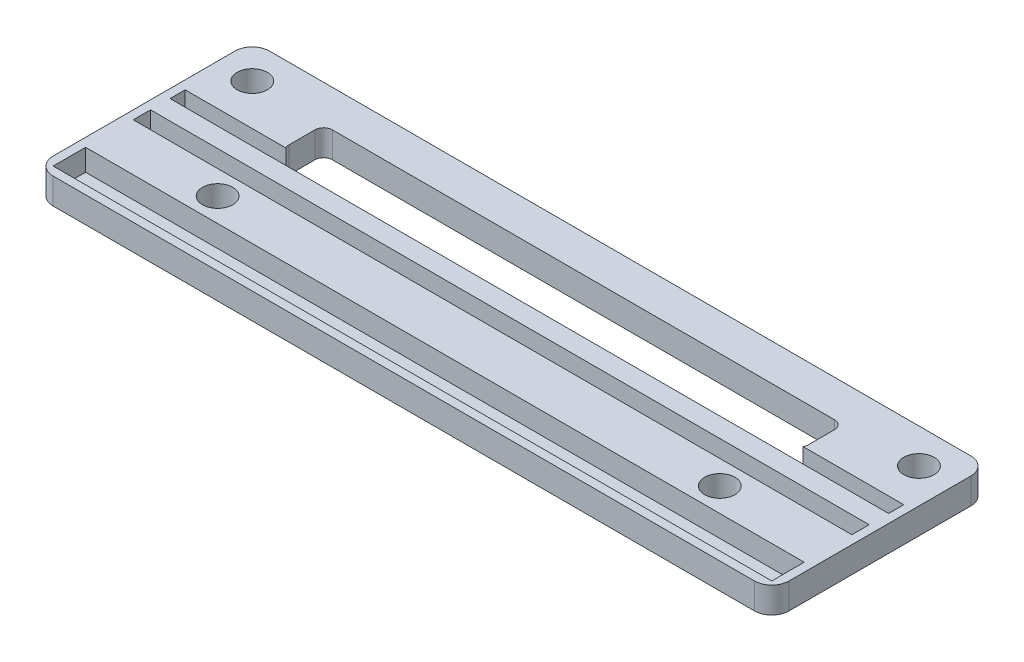
from build123d import *

# Parameters (mm, degrees)
SKETCH1_W           = 85
SKETCH1_H           = 25
BOSS_EXTRUDE1_DEPTH = 3
SKETCH2_W           = 83
SKETCH2_H           = 3.75
SKETCH2_H_2         = 2
SKETCH2_H_3         = 1.75
CUT_EXTRUDE1_DEPTH  = 2.5
SKETCH3_R           = 1.75
CUT_EXTRUDE2_DEPTH  = 45.401576549
SKETCH4_W           = 60
SKETCH4_H           = 5
CUT_EXTRUDE3_DEPTH  = 45.401576549
FILLET1_R           = 1
FILLET2_R           = 2


with BuildPart() as part:
    # Sketch1 → Boss-Extrude1 (new body)
    with BuildSketch(Plane(origin=(0, 0, 0), x_dir=(1, 0, 0), z_dir=(0, 1, 0))):
        Rectangle(SKETCH1_W, SKETCH1_H)
    extrude(amount=BOSS_EXTRUDE1_DEPTH)

    # Sketch2 → Cut-Extrude1 (cut)
    with BuildSketch(Plane(origin=(0, 3, 0), x_dir=(1, 0, 0), z_dir=(0, 1, 0))):
        with Locations((0, -9.625)):
            Rectangle(SKETCH2_W, SKETCH2_H)
        with Locations((0, -1.25)):
            Rectangle(SKETCH2_W, SKETCH2_H_2)
        with Locations((0, 2.875)):
            Rectangle(SKETCH2_W, SKETCH2_H_3)
    extrude(amount=-CUT_EXTRUDE1_DEPTH, mode=Mode.SUBTRACT)

    # Sketch3 → Cut-Extrude2 (cut, through all)
    with BuildSketch(Plane(origin=(0, 3, 0), x_dir=(1, 0, 0), z_dir=(0, 1, 0))):
        with Locations(Location((-38.5, 8.5, 0), (0, 0, 270))):
            Circle(SKETCH3_R)
        with Locations(Location((38.5, 8.5, 0), (0, 0, 90))):
            Circle(SKETCH3_R)
        with Locations(Location((-29, -5, 0), (0, 0, 270))):
            Circle(SKETCH3_R)
        with Locations(Location((29, -5, 0), (0, 0, 90))):
            Circle(SKETCH3_R)
    extrude(amount=-CUT_EXTRUDE2_DEPTH, mode=Mode.SUBTRACT)

    # Sketch4 → Cut-Extrude3 (cut, through all)
    with BuildSketch(Plane(origin=(0, 3, 0), x_dir=(1, 0, 0), z_dir=(0, 1, 0))):
        with Locations((0, 5.75)):
            Rectangle(SKETCH4_W, SKETCH4_H)
    extrude(amount=-CUT_EXTRUDE3_DEPTH, mode=Mode.SUBTRACT)

    # Fillet1
    fillet1_edges = [part.edges().sort_by_distance(p)[0] for p in [
        (30, 0.25, -3.25),
        (30, 1.5, -8.25),
        (-30, 1.5, -8.25),
        (-30, 0.25, -3.25),
    ]]
    fillet(fillet1_edges, radius=FILLET1_R)

    # Fillet2
    fillet2_edges = [part.edges().sort_by_distance(p)[0] for p in [
        (-42.5, 1.5, -12.5),
        (42.5, 1.5, -12.5),
        (42.5, 1.5, 12.5),
        (-42.5, 1.5, 12.5),
    ]]
    fillet(fillet2_edges, radius=FILLET2_R)


solid = part.part
